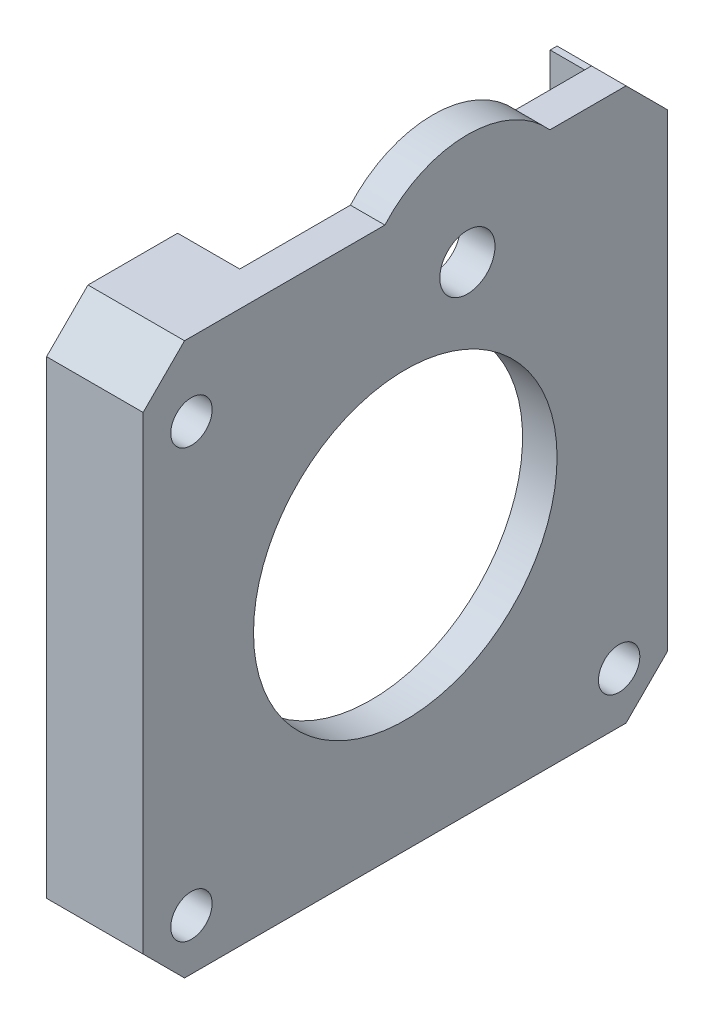
from build123d import *

# Parameters (mm, degrees)
SKETCH1_R           = 1.5
SKETCH1_R_2         = 11
SKETCH1_R_3         = 2
BOSS_EXTRUDE1_DEPTH = 7
CUT_EXTRUDE1_DEPTH  = 4.5
SKETCH3_W           = 33.429321272
SKETCH3_H           = 5.85707368
CUT_EXTRUDE2_DEPTH  = 4.5
CHAMFER1_SIZE       = 3


with BuildPart() as part:
    # Sketch1 → Boss-Extrude1 (new body)
    with BuildSketch(Plane(origin=(0, 0, 0), x_dir=(0, 0, -1), z_dir=(1, 0, 0))):
        with BuildLine():
            Line((10.478493311, 20.815789474), (19, 20.815789474))
            Line((19, 20.815789474), (19, -19.184210526))
            Line((19, -19.184210526), (-19, -19.184210526))
            Line((-19, -19.184210526), (-19, 20.815789474))
            Line((-19, 20.815789474), (-1.478493311, 20.815789474))
            ThreePointArc((-1.478493311, 20.815789474), (4.5, 23.5), (10.478493311, 20.815789474))
        make_face()
        with Locations((15.5, -15.5)):
            Circle(SKETCH1_R, mode=Mode.SUBTRACT)
        with Locations((-15.5, 15.5)):
            Circle(SKETCH1_R, mode=Mode.SUBTRACT)
        with Locations((-15.5, -15.5)):
            Circle(SKETCH1_R, mode=Mode.SUBTRACT)
        Circle(SKETCH1_R_2, mode=Mode.SUBTRACT)
        with Locations((4.5, 15.5)):
            Circle(SKETCH1_R_3, mode=Mode.SUBTRACT)
    extrude(amount=BOSS_EXTRUDE1_DEPTH)

    # Sketch2 → Cut-Extrude1 (cut)
    with BuildSketch(Plane.ZY):
        with BuildLine():
            Line((-17.5, -13), (-17.5, 18.815789474))
            Line((-17.5, 18.815789474), (13, 18.815789474))
            Line((13, 18.815789474), (13, 15.5))
            ThreePointArc((13, 15.5), (13.732233047, 13.732233047), (15.5, 13))
            Line((15.5, 13), (17.5, 13))
            Line((17.5, 13), (17.5, -13))
            Line((17.5, -13), (15.5, -13))
            ThreePointArc((15.5, -13), (13.732233047, -13.732233047), (13, -15.5))
            Line((13, -15.5), (13, -17.684210526))
            Line((13, -17.684210526), (-13, -17.684210526))
            Line((-13, -17.684210526), (-13, -15.5))
            ThreePointArc((-13, -15.5), (-13.732233047, -13.732233047), (-15.5, -13))
            Line((-15.5, -13), (-17.5, -13))
        make_face()
    extrude(amount=-CUT_EXTRUDE1_DEPTH, mode=Mode.SUBTRACT)

    # Sketch3 → Cut-Extrude2 (cut)
    with BuildSketch(Plane.ZY):
        with Locations((-7.214660636, 21.744326314)):
            Rectangle(SKETCH3_W, SKETCH3_H)
    extrude(amount=-CUT_EXTRUDE2_DEPTH, mode=Mode.SUBTRACT)

    # Chamfer1
    chamfer1_edges = [part.edges().sort_by_distance(p)[0] for p in [
        (3.5, -19.184210526, -19),
        (3.5, -19.184210526, 19),
        (3.5, 20.815789474, 19),
        (5.75, 20.815789474, -19),
    ]]
    chamfer(chamfer1_edges, length=CHAMFER1_SIZE)


solid = part.part
